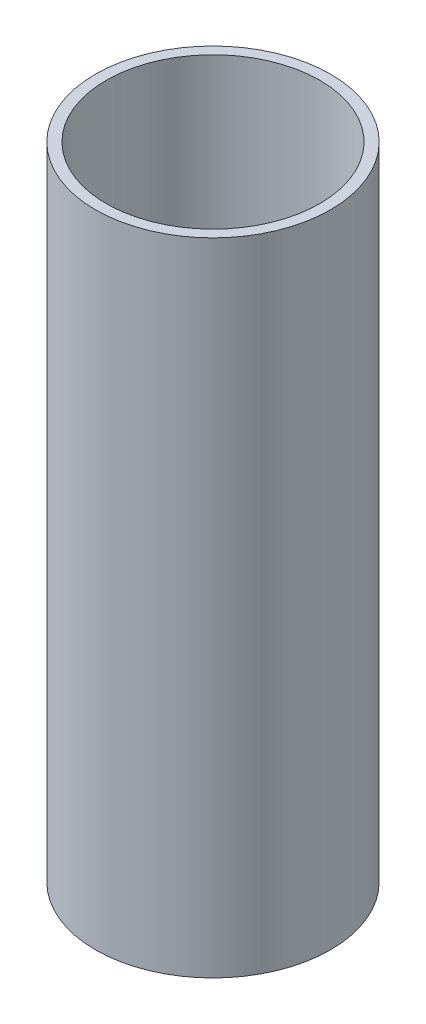
from build123d import *

# Parameters (mm, degrees)
SKETCH1_R           = 13.97
SKETCH1_R_2         = 12.7
BOSS_EXTRUDE1_DEPTH = 76.2


with BuildPart() as part:
    # Sketch1 → Boss-Extrude1 (new body)
    with BuildSketch(Plane(origin=(0, 0, 0), x_dir=(1, 0, 0), z_dir=(0, 1, 0))):
        with Locations(Location((0, 0, 0), (0, 0, 90))):
            Circle(SKETCH1_R)
        with Locations(Location((0, 0, 0), (0, 0, 90))):
            Circle(SKETCH1_R_2, mode=Mode.SUBTRACT)
    extrude(amount=BOSS_EXTRUDE1_DEPTH)


solid = part.part
